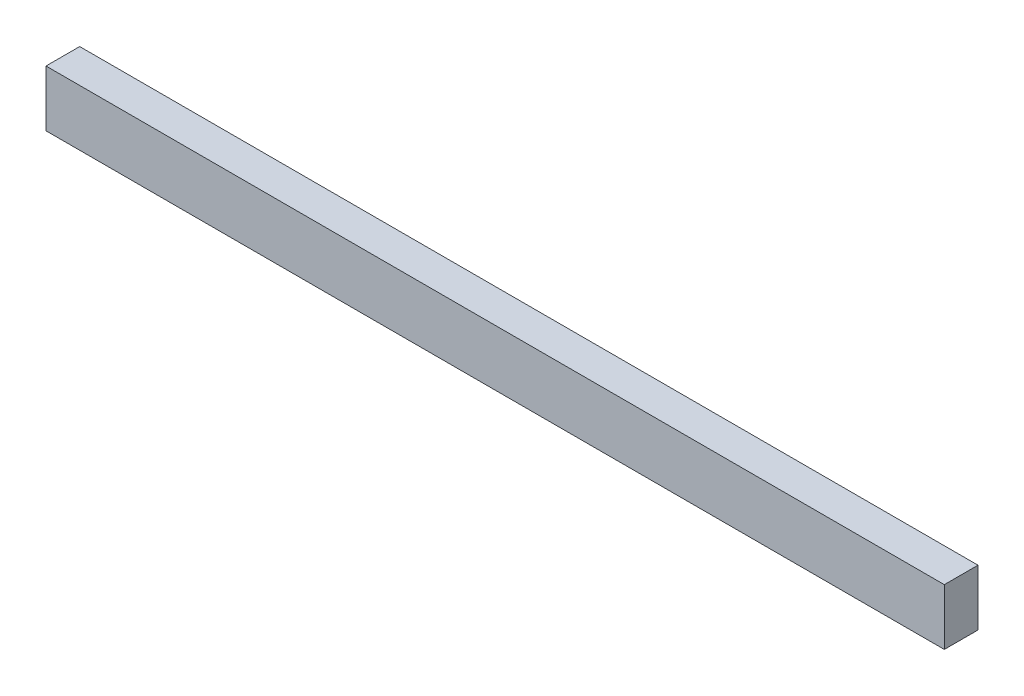
from build123d import *

# Parameters (mm, degrees)
SKETCH1_W           = 80
SKETCH1_H           = 5
BOSS_EXTRUDE1_DEPTH = 3


with BuildPart() as part:
    # Sketch1 → Boss-Extrude1 (new body)
    with BuildSketch(Plane.XY):
        Rectangle(SKETCH1_W, SKETCH1_H)
    extrude(amount=BOSS_EXTRUDE1_DEPTH)


solid = part.part
